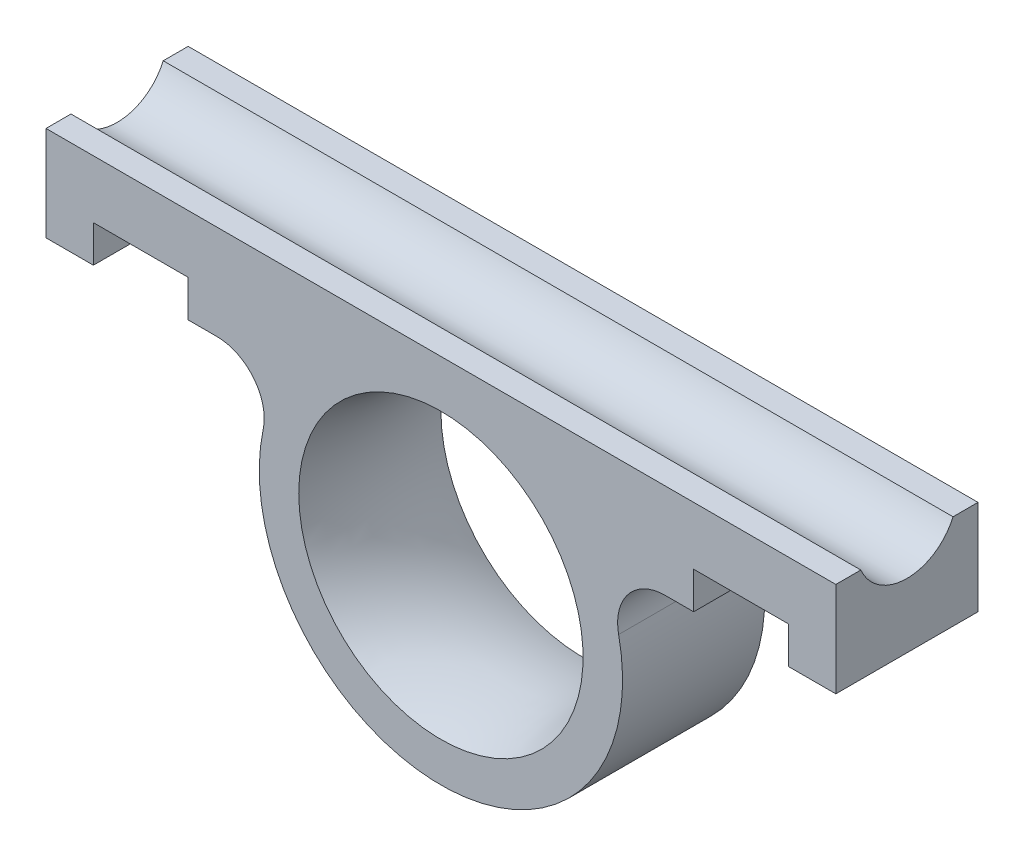
from build123d import *

# Parameters (mm, degrees)
SKETCH2_R           = 8.25
BOSS_EXTRUDE1_DEPTH = 9
SKETCH3_R           = 3.175
CUT_EXTRUDE1_DEPTH  = 53.201532545
SKETCH4_OUTSIDE_W   = 22.196
SKETCH4_OUTSIDE_H   = 36.696
SKETCH4_OUTSIDE_R   = 8.25
CUT_EXTRUDE2_DEPTH  = 6
CUT_EXTRUDE3_DEPTH  = 6


with BuildPart() as part:
    # Sketch2 → Boss-Extrude1 (new body)
    with BuildSketch(Plane.XY):
        with BuildLine():
            Line((-25, 12), (25, 12))
            Line((25, 12), (25, 6))
            Line((25, 6), (22, 6))
            Line((22, 6), (22, 7))
            Line((22, 7), (16, 7))
            Line((16, 7), (16, 6))
            Line((16, 6), (14.186260959, 6))
            ThreePointArc((14.186260959, 6), (11.855802961, 4.88917059), (11.251172485, 2.379310345))
            ThreePointArc((11.251172485, 2.379310345), (0, -11.5), (-11.251172485, 2.379310345))
            ThreePointArc((-11.251172485, 2.379310345), (-11.855802961, 4.88917059), (-14.186260959, 6))
            Line((-14.186260959, 6), (-16, 6))
            Line((-16, 6), (-16, 7))
            Line((-16, 7), (-22, 7))
            Line((-22, 7), (-22, 6))
            Line((-22, 6), (-25, 6))
            Line((-25, 6), (-25, 12))
        make_face()
        Circle(SKETCH2_R, mode=Mode.SUBTRACT)
    extrude(amount=BOSS_EXTRUDE1_DEPTH)

    # Sketch3 → Cut-Extrude1 (cut, through all)
    with BuildSketch(Plane(origin=(25, 0, 0), x_dir=(0, 0, -1), z_dir=(1, 0, 0))):
        with Locations((-4.5, 13.25)):
            Circle(SKETCH3_R)
    extrude(amount=-CUT_EXTRUDE1_DEPTH, mode=Mode.SUBTRACT)

    # Sketch4 outside → Cut-Extrude2 (cut)
    with BuildSketch(Plane(origin=(-22, 0, 0), x_dir=(0, 0, -1), z_dir=(1, 0, 0))):
        with Locations((-4.5, 0.25)):
            Rectangle(SKETCH4_OUTSIDE_W, SKETCH4_OUTSIDE_H)
        with Locations((-4.5, 15.25)):
            Circle(SKETCH4_OUTSIDE_R, mode=Mode.SUBTRACT)
    extrude(amount=CUT_EXTRUDE2_DEPTH, mode=Mode.SUBTRACT)

    # Sketch5 → Cut-Extrude3 (cut)
    with BuildSketch(Plane.ZY.offset(-16)):
        with BuildLine():
            Line((0, 8.335341657), (0, 6))
            Line((0, 6), (9, 6))
            Line((9, 6), (9, 8.335341657))
            ThreePointArc((9, 8.335341657), (4.5, 7), (0, 8.335341657))
        make_face()
    extrude(amount=-CUT_EXTRUDE3_DEPTH, mode=Mode.SUBTRACT)

    # Sketch6 → Cut-Revolve1 (revolve, cut)
    with BuildSketch(Plane(origin=(0, 0, 0), x_dir=(0, 0, -1), z_dir=(1, 0, 0)), mode=Mode.PRIVATE) as cut_revolve1_sk:
        with BuildLine():
            Line((-9, 9), (-9, 0))
            Line((-9, 0), (0, 0))
            Line((0, 0), (0, 9))
            ThreePointArc((0, 9), (-4.5, 8.25), (-9, 9))
        make_face()
    revolve(cut_revolve1_sk.sketch.rotate(Axis((0, 0, 9), (0, 0, 1)), 90), axis=Axis((0, 0, 9), (0, 0, 1)), mode=Mode.SUBTRACT)


solid = part.part
